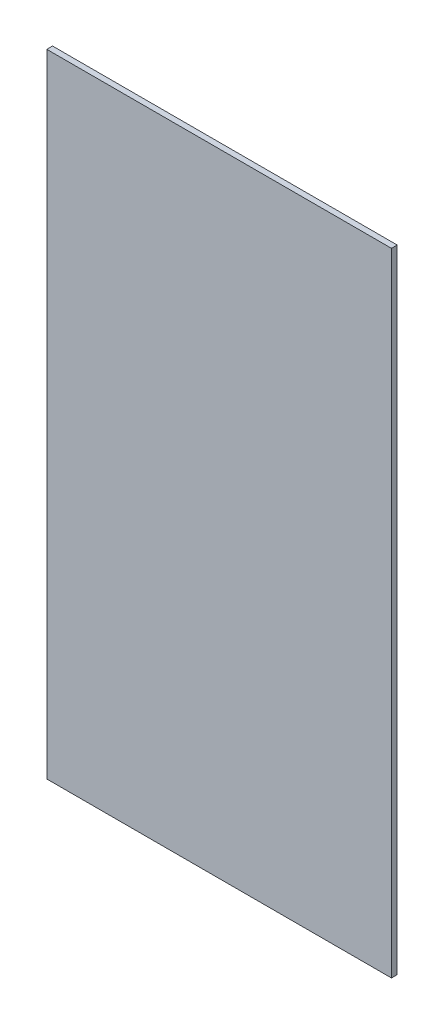
from build123d import *

# Parameters (mm, degrees)
SKETCH1_W           = 60
SKETCH1_H           = 110
BOSS_EXTRUDE1_DEPTH = 1


with BuildPart() as part:
    # Sketch1 → Boss-Extrude1 (new body)
    with BuildSketch(Plane.XY):
        with Locations((30, 55)):
            Rectangle(SKETCH1_W, SKETCH1_H)
    extrude(amount=BOSS_EXTRUDE1_DEPTH)


solid = part.part
